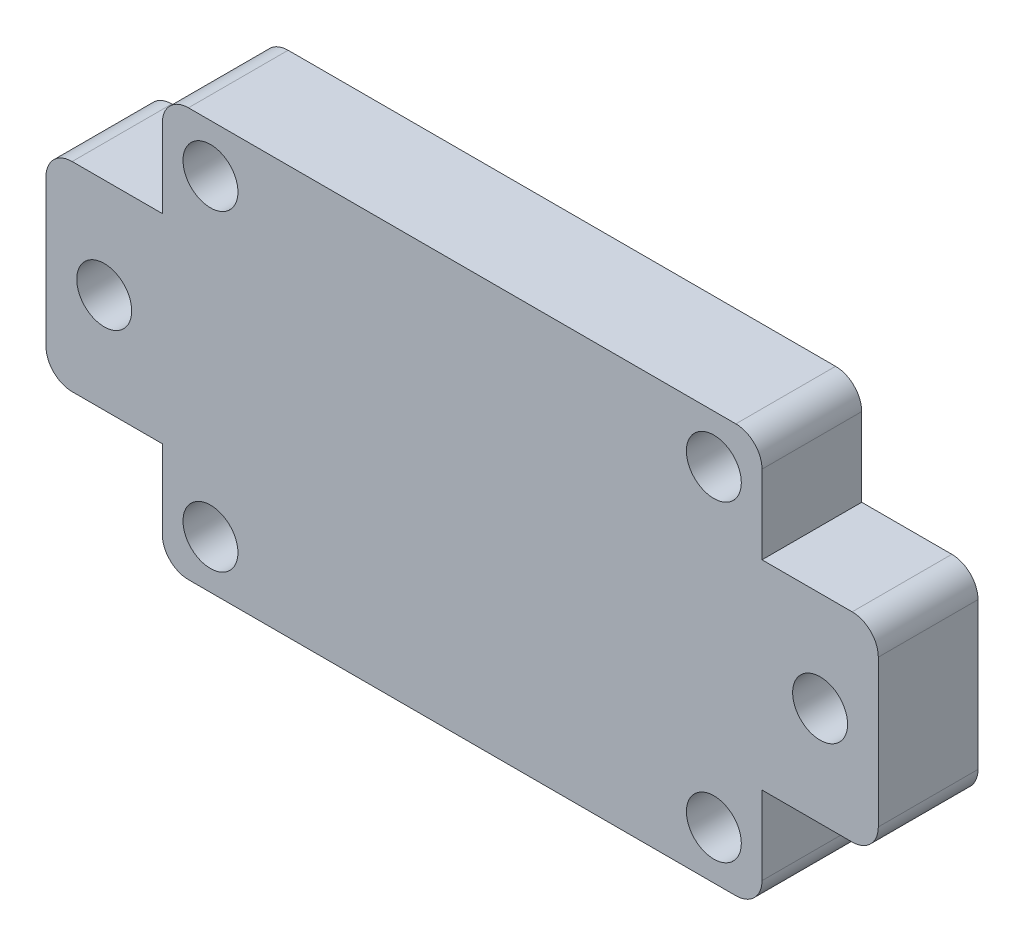
from build123d import *

# Parameters (mm, degrees)
BOSS_EXTRUDE1_DEPTH = 7.62
SKETCH3_R           = 2.099999991
SKETCH3_R_2         = 2.1
CUT_EXTRUDE1_DEPTH  = 170.067196777
SKETCH3_3_R         = 2.1
CUT_EXTRUDE2_DEPTH  = 6.35
FILLET1_R           = 2


with BuildPart() as part:
    # Sketch2 → Boss-Extrude1 (new body)
    with BuildSketch(Plane(origin=(0, 0, -0.41148), x_dir=(-1, 0, 0), z_dir=(0, 0, -1))):
        Polygon((-92.964, 58.674), (-92.964, 50.673), (-138.811, 50.673), (-138.811, 58.674), (-147.701, 58.674), (-147.701, 66.294), (-147.701, 73.914), (-138.811, 73.914), (-138.811, 81.915), (-92.964, 81.915), (-92.964, 73.914), (-84.074, 73.914), (-84.074, 66.294), (-84.074, 58.674), align=None)
    extrude(amount=BOSS_EXTRUDE1_DEPTH)

    # Sketch3 → Cut-Extrude1 (cut, through all)
    with BuildSketch(Plane.XY.offset(-0.41148)):
        with Locations((88.524, 66.294)):
            Circle(SKETCH3_R)
        with Locations((143.251, 66.294)):
            Circle(SKETCH3_R_2)
    extrude(amount=-CUT_EXTRUDE1_DEPTH, mode=Mode.SUBTRACT)

    # Sketch3<3> → Cut-Extrude2 (cut)
    with BuildSketch(Plane.XY.offset(-0.41148)):
        with Locations((96.647, 78.232)):
            Circle(SKETCH3_3_R)
        with Locations((135.128, 78.232)):
            Circle(SKETCH3_3_R)
        with Locations((135.128, 54.356)):
            Circle(SKETCH3_3_R)
        with Locations((96.647, 54.356)):
            Circle(SKETCH3_3_R)
    extrude(amount=-CUT_EXTRUDE2_DEPTH, mode=Mode.SUBTRACT)

    # Fillet1
    fillet1_edges = [part.edges().sort_by_distance(p)[0] for p in [
        (147.701, 58.674, -4.22148),
        (147.701, 73.914, -4.22148),
        (138.811, 81.915, -4.22148),
        (138.811, 50.673, -4.22148),
        (92.964, 81.915, -4.22148),
        (84.074, 73.914, -4.22148),
        (92.964, 50.673, -4.22148),
        (84.074, 58.674, -4.22148),
    ]]
    fillet(fillet1_edges, radius=FILLET1_R)


solid = part.part
